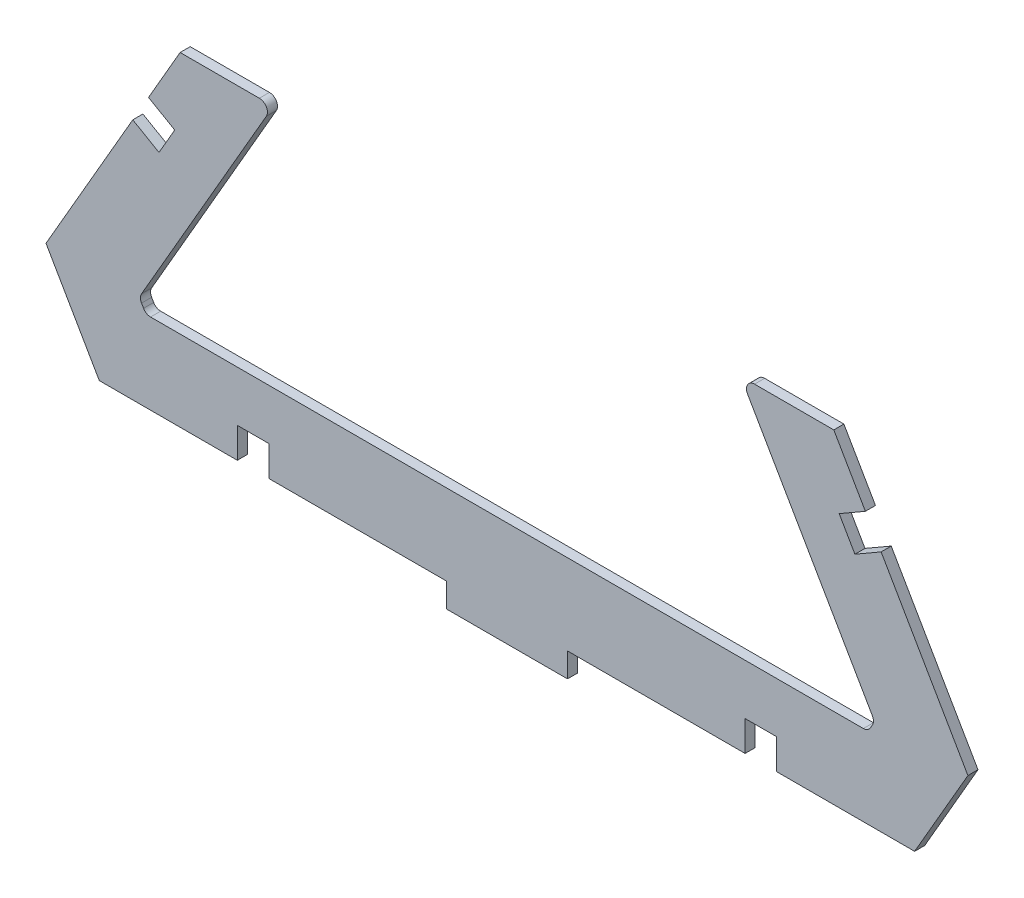
from build123d import *

# Parameters (mm, degrees)
BOSS_EXTRUDE1_DEPTH = 3.175
SKETCH2_W           = 9.906
SKETCH2_H           = 9.525
CUT_EXTRUDE1_DEPTH  = 190.835760674
FILLET1_R           = 2.54


with BuildPart() as part:
    # Sketch1 → Boss-Extrude1 (new body)
    with BuildSketch(Plane.XY):
        Polygon((19.05, 0), (-19.05, 0), (-19.05, 7.62), (-128.27, 7.62), (-145.034, 36.656099738), (-95.504, 122.444576237), (-73.506954744, 109.744576237), (-115.704606325, 36.656099738), (-113.605303163, 33.02), (113.605303163, 33.02), (115.704606325, 36.656099738), (73.506954744, 109.744576237), (95.504, 122.444576237), (145.034, 36.656099738), (128.27, 7.62), (19.05, 7.62), align=None)
    extrude(amount=BOSS_EXTRUDE1_DEPTH)

    # Sketch2 → Cut-Extrude1 (cut, through all)
    with BuildSketch(Plane.XY.offset(3.175)):
        with Locations((-79.883, 12.3825)):
            Rectangle(SKETCH2_W, SKETCH2_H)
        Polygon((-112.776, 92.528594689), (-104.527108029, 87.766094689), (-109.480108029, 79.187247039), (-117.729, 83.949747039), align=None)
        Polygon((-73.506954744, 109.744576237), (-102.836348419, 109.744576237), (-95.504, 122.444576237), align=None)
        Polygon((95.504, 122.444576237), (73.506954744, 109.744576237), (102.836348419, 109.744576237), align=None)
        Polygon((117.729, 83.949747039), (112.776, 92.528594689), (104.527108029, 87.766094689), (109.480108029, 79.187247039), align=None)
        with Locations((79.883, 12.3825)):
            Rectangle(SKETCH2_W, SKETCH2_H)
    extrude(amount=-CUT_EXTRUDE1_DEPTH, mode=Mode.SUBTRACT)

    # Fillet1
    fillet1_edges = [part.edges().sort_by_distance(p)[0] for p in [
        (-113.605303163, 33.02, 1.5875),
        (113.605303163, 33.02, 1.5875),
        (115.704606325, 36.656099738, 1.5875),
        (73.506954744, 109.744576237, 1.5875),
        (-73.506954744, 109.744576237, 1.5875),
        (-115.704606325, 36.656099738, 1.5875),
    ]]
    fillet(fillet1_edges, radius=FILLET1_R)


solid = part.part
